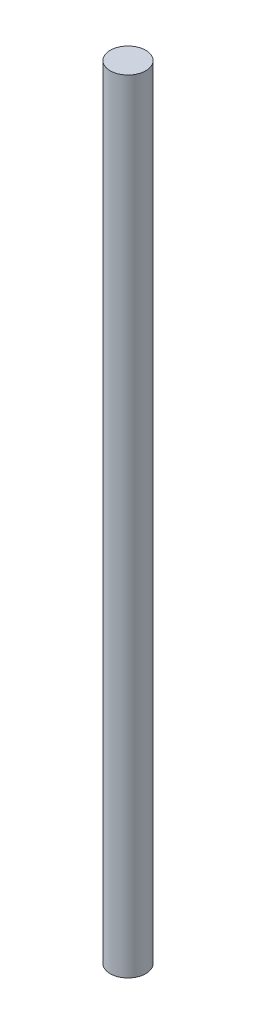
from build123d import *

# Parameters (mm, degrees)
SKETCH_1_R      = 1
EXTRUDE_1_DEPTH = 44


with BuildPart() as part:
    # 草图1 → 凸台-拉伸1 (new body)
    with BuildSketch(Plane(origin=(0, 0, 0), x_dir=(1, 0, 0), z_dir=(0, 1, 0))):
        with Locations(Location((0, 0, 0), (0, 0, 270))):
            Circle(SKETCH_1_R)
    extrude(amount=EXTRUDE_1_DEPTH)


solid = part.part
